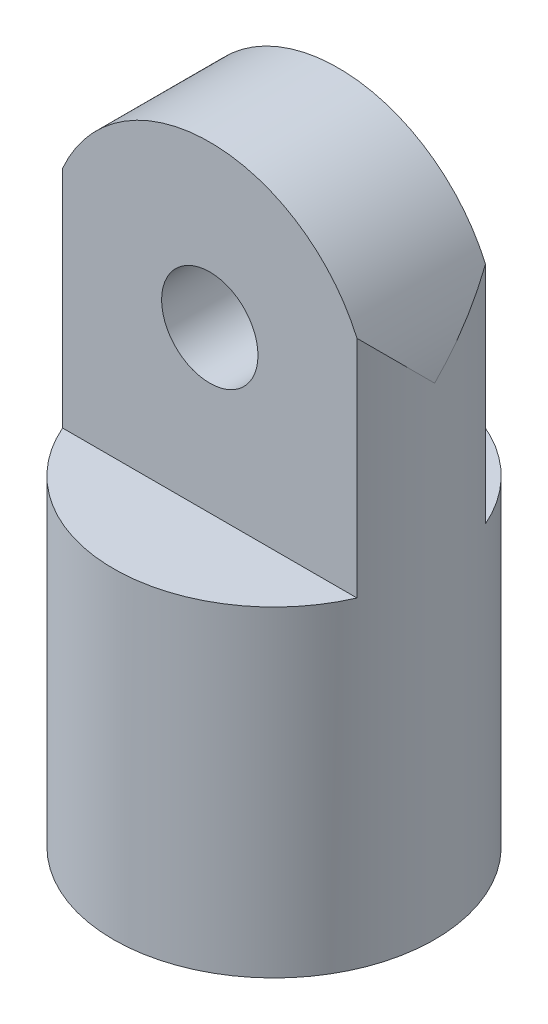
from build123d import *

# Parameters (mm, degrees)
SKETCH_1_R               = 50
EXTRUDE_1_DEPTH          = 200
CUT_EXTRUDE_1_DEPTH      = 200
CUT_EXTRUDE_1_DEPTH_BACK = 200
CUT_EXTRUDE_4_DEPTH      = 200
CUT_EXTRUDE_4_DEPTH_BACK = 200
CUT_EXTRUDE_5_DEPTH      = 200
CUT_EXTRUDE_5_DEPTH_BACK = 200
SKETCH_5_R               = 15


with BuildPart() as part:
    # 草图1 → 凸台-拉伸1 (new body)
    with BuildSketch(Plane(origin=(0, 0, 0), x_dir=(1, 0, 0), z_dir=(0, 1, 0))):
        Circle(SKETCH_1_R)
    extrude(amount=EXTRUDE_1_DEPTH)

    # 草图2 → 切除-拉伸1 (cut, two sides: drawn at the far end of the back side and taken through both)
    with BuildSketch(Plane(origin=(0, 0, 0), x_dir=(0, 0, -1), z_dir=(1, 0, 0)).offset(-CUT_EXTRUDE_1_DEPTH_BACK)):
        Polygon((-70, 250), (70, 250), (70, 100), (20, 100), (20, 240), (-20, 240), (-20, 100), (-70, 100), align=None)
    extrude(amount=CUT_EXTRUDE_1_DEPTH + CUT_EXTRUDE_1_DEPTH_BACK, mode=Mode.SUBTRACT)

    # 草图3 → 切除-拉伸4 (cut, two sides: drawn at the far end of the back side and taken through both)
    with BuildSketch(Plane.XY.offset(20).offset(-CUT_EXTRUDE_4_DEPTH_BACK)):
        with BuildLine():
            Line((50, 150), (108.18036677, 150))
            Line((108.18036677, 150), (108.18036677, 270))
            Line((108.18036677, 270), (-86.328849113, 270))
            Line((-86.328849113, 270), (-86.328849113, 150))
            Line((-86.328849113, 150), (-50, 150))
            ThreePointArc((-50, 150), (0, 200), (50, 150))
        make_face()
    extrude(amount=CUT_EXTRUDE_4_DEPTH + CUT_EXTRUDE_4_DEPTH_BACK, mode=Mode.SUBTRACT)

    # 草图5 → 切除-拉伸5 (cut, two sides: drawn at the far end of the back side and taken through both)
    with BuildSketch(Plane.XY.offset(20).offset(-CUT_EXTRUDE_5_DEPTH_BACK)):
        with Locations((0, 150)):
            Circle(SKETCH_5_R)
    extrude(amount=CUT_EXTRUDE_5_DEPTH + CUT_EXTRUDE_5_DEPTH_BACK, mode=Mode.SUBTRACT)


solid = part.part
